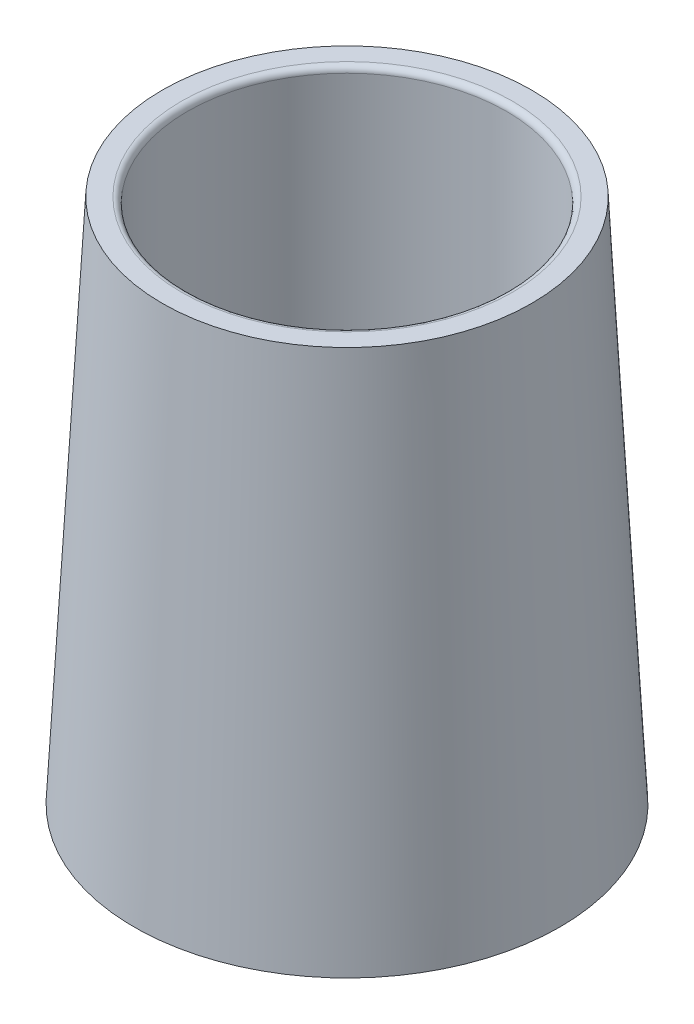
from build123d import *

# Parameters (mm, degrees)
SKETCH_2_R          = 27
CUT_EXTRUDE_1_DEPTH = 57
SKETCH_3_R          = 28.9
CUT_EXTRUDE_2_DEPTH = 11
SKETCH_4_R          = 23
CUT_EXTRUDE_3_DEPTH = 94.145048178
FILLET_1_R          = 1
FILLET_3_R          = 1


with BuildPart() as part:
    # 草圖1 → 旋轉1 (revolve)
    with BuildSketch(Plane.XY, mode=Mode.PRIVATE) as revolve_1_sk:
        Polygon((0, 0), (36, 0), (31.25, 89), (0, 89), align=None)
    revolve(revolve_1_sk.sketch.rotate(Axis((0, 89, 0), (0, -1, 0)), 180), axis=Axis((0, 89, 0), (0, -1, 0)))

    # 草圖2 → 除料-伸長1 (cut)
    with BuildSketch(Plane(origin=(0, 89, 0), x_dir=(1, 0, 0), z_dir=(0, 1, 0))):
        with Locations(Location((0, 0, 0), (0, 0, 180))):
            Circle(SKETCH_2_R)
    extrude(amount=-CUT_EXTRUDE_1_DEPTH, mode=Mode.SUBTRACT)

    # 草圖3 → 除料-伸長2 (cut)
    with BuildSketch(Plane.XZ):
        Circle(SKETCH_3_R)
    extrude(amount=-CUT_EXTRUDE_2_DEPTH, mode=Mode.SUBTRACT)

    # 草圖4 → 除料-伸長3 (cut, through all)
    with BuildSketch(Plane.XZ.offset(-11)):
        Circle(SKETCH_4_R)
    extrude(amount=-CUT_EXTRUDE_3_DEPTH, mode=Mode.SUBTRACT)

    # 圓角1
    fillet_1_edges = [part.edges().sort_by_distance(p)[0] for p in [
        (27, 89, 0),
    ]]
    fillet(fillet_1_edges, radius=FILLET_1_R)

    # 圓角3
    fillet_3_edges = [part.edges().sort_by_distance(p)[0] for p in [
        (-23, 32, 0),
        (-23, 11, 0),
    ]]
    fillet(fillet_3_edges, radius=FILLET_3_R)


solid = part.part
